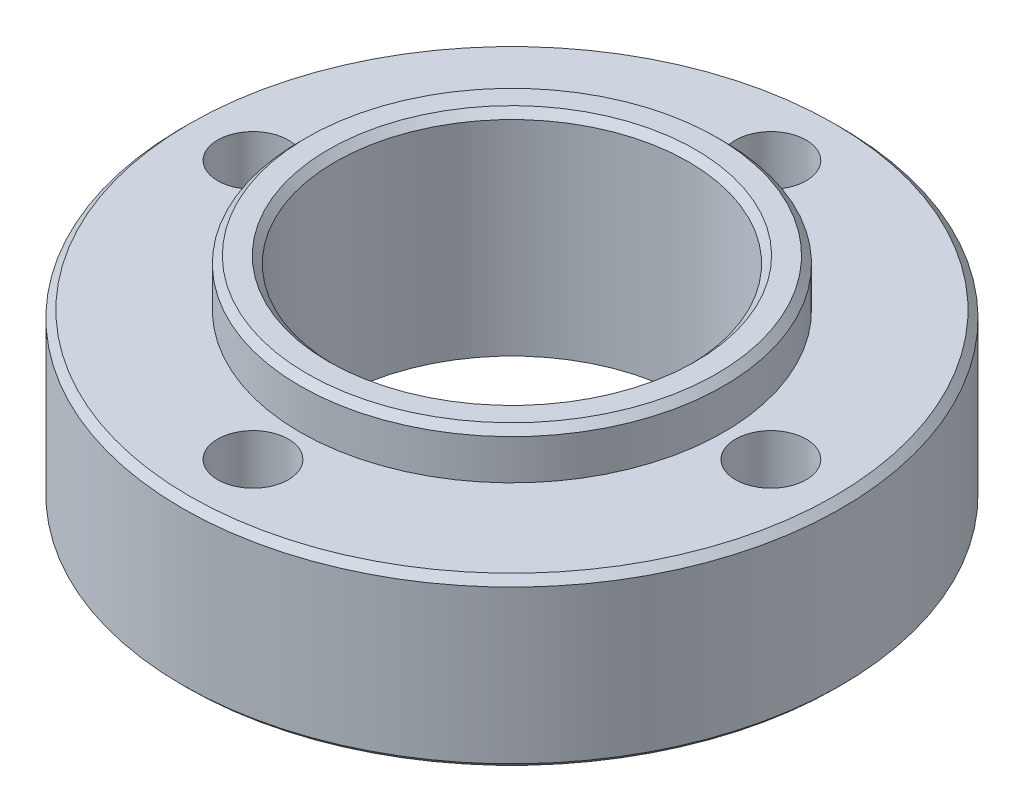
from build123d import *

# Parameters (mm, degrees)
SKETCH_1_R      = 14
SKETCH_1_R_2    = 1.5
SKETCH_1_R_3    = 9
SKETCH_1_R_4    = 7.5
EXTRUDE_1_DEPTH = 7
SKETCH_1_3_R    = 9
SKETCH_1_3_R_2  = 7.5
EXTRUDE_2_DEPTH = 9
CHAMFER_1_SIZE  = 0.3
CHAMFER_4_SIZE  = 0.2


with BuildPart() as part:
    # Эскиз1 → Бобышка-Вытянуть1 (new body)
    # profile 1 of 2: a face of its own
    with BuildSketch(Plane(origin=(0, 0, 0), x_dir=(1, 0, 0), z_dir=(0, 1, 0))):
        with Locations(Location((0, 0, 0), (0, 0, 270))):
            Circle(SKETCH_1_R)
        with Locations(Location((-11, 0, 0), (0, 0, 270))):
            Circle(SKETCH_1_R_2, mode=Mode.SUBTRACT)
        with Locations(Location((0, -11, 0), (0, 0, 270))):
            Circle(SKETCH_1_R_2, mode=Mode.SUBTRACT)
        with Locations(Location((11, 0, 0), (0, 0, 270))):
            Circle(SKETCH_1_R_2, mode=Mode.SUBTRACT)
        with Locations(Location((0, 11, 0), (0, 0, 270))):
            Circle(SKETCH_1_R_2, mode=Mode.SUBTRACT)
        Circle(SKETCH_1_R_3, mode=Mode.SUBTRACT)
    # profile 2 of 2: a face of its own
    with BuildSketch(Plane(origin=(0, 0, 0), x_dir=(1, 0, 0), z_dir=(0, 1, 0))):
        Circle(SKETCH_1_R_3)
        with Locations(Location((0, 0, 0), (0, 0, 270))):
            Circle(SKETCH_1_R_4, mode=Mode.SUBTRACT)
    extrude(amount=EXTRUDE_1_DEPTH)

    # Эскиз1<3> → Бобышка-Вытянуть2 (add)
    with BuildSketch(Plane(origin=(0, 0, 0), x_dir=(1, 0, 0), z_dir=(0, 1, 0))):
        with Locations(Location((0, 0, 0), (0, 0, 270))):
            Circle(SKETCH_1_3_R)
        with Locations(Location((0, 0, 0), (0, 0, 270))):
            Circle(SKETCH_1_3_R_2, mode=Mode.SUBTRACT)
    extrude(amount=EXTRUDE_2_DEPTH)

    # Фаска1
    chamfer_1_edges = [part.edges().sort_by_distance(p)[0] for p in [
        (0, 9, -7.5),
        (0, 9, -9),
        (0, 7, -14),
    ]]
    chamfer(chamfer_1_edges, length=CHAMFER_1_SIZE)

    # Фаска4
    chamfer_4_edges = [part.edges().sort_by_distance(p)[0] for p in [
        (0, 0, -14),
    ]]
    chamfer(chamfer_4_edges, length=CHAMFER_4_SIZE)


solid = part.part
